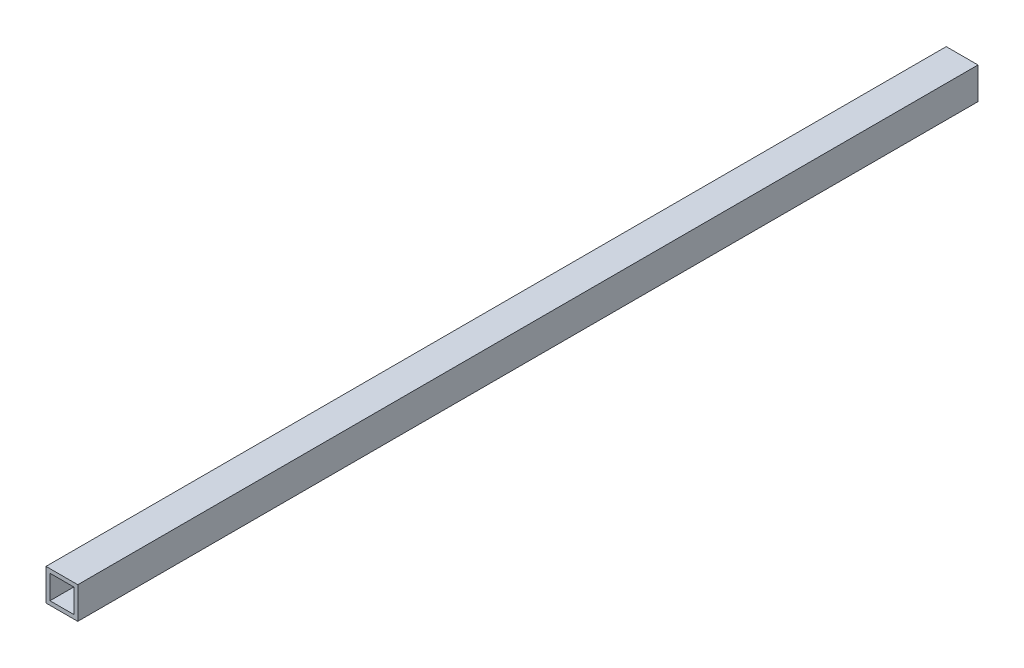
from build123d import *

# Parameters (mm, degrees)
SKETCH1_W           = 12
SKETCH1_H           = 12
BOSS_EXTRUDE1_DEPTH = 340
SHELL1_T            = -1.5


with BuildPart() as part:
    # Sketch1 → Boss-Extrude1 (new body)
    with BuildSketch(Plane.XY):
        Rectangle(SKETCH1_W, SKETCH1_H)
    extrude(amount=BOSS_EXTRUDE1_DEPTH)

    # Shell1
    shell1_openings = [part.faces().sort_by_distance(p)[0] for p in [
        (0, 0, 340),
        (0, 0, 0),
    ]]
    offset(amount=SHELL1_T, openings=shell1_openings, kind=Kind.INTERSECTION)


solid = part.part
